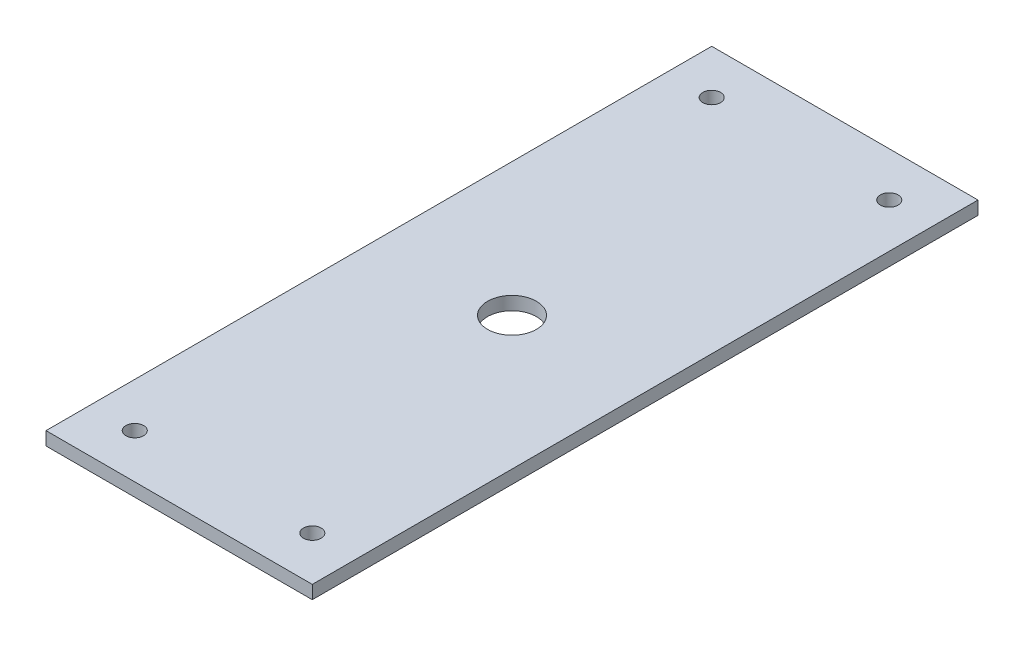
from build123d import *

# Parameters (mm, degrees)
SKETCH1_W           = 120
SKETCH1_H           = 300
SKETCH1_R           = 11
SKETCH1_R_2         = 4
BOSS_EXTRUDE1_DEPTH = 6


with BuildPart() as part:
    # Sketch1 → Boss-Extrude1 (new body)
    with BuildSketch(Plane(origin=(0, 0, 0), x_dir=(1, 0, 0), z_dir=(0, 1, 0))):
        Rectangle(SKETCH1_W, SKETCH1_H)
        with Locations(Location((0, 0, 0), (0, 0, 270))):
            Circle(SKETCH1_R, mode=Mode.SUBTRACT)
        with Locations(Location((40, -130, 0), (0, 0, 270))):
            Circle(SKETCH1_R_2, mode=Mode.SUBTRACT)
        with Locations(Location((-40, -130, 0), (0, 0, 270))):
            Circle(SKETCH1_R_2, mode=Mode.SUBTRACT)
        with Locations(Location((40, 130, 0), (0, 0, 270))):
            Circle(SKETCH1_R_2, mode=Mode.SUBTRACT)
        with Locations(Location((-40, 130, 0), (0, 0, 270))):
            Circle(SKETCH1_R_2, mode=Mode.SUBTRACT)
    extrude(amount=BOSS_EXTRUDE1_DEPTH)


solid = part.part
